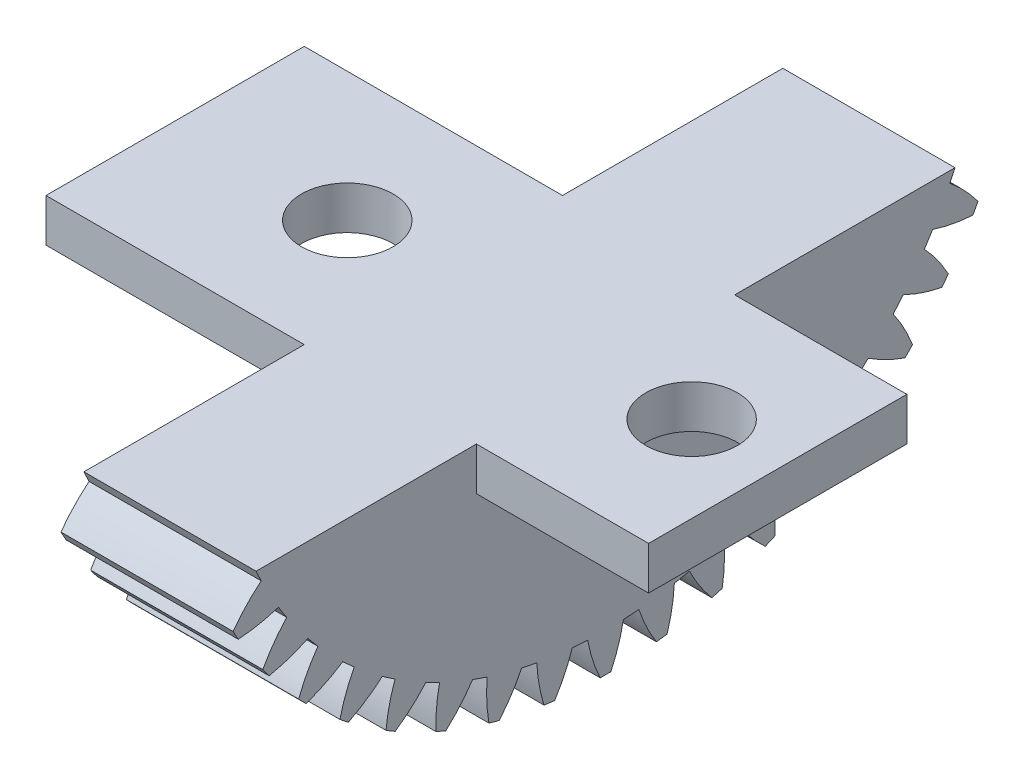
from build123d import *

# Parameters (mm, degrees)
BASPROSKE_W              = 12.7
BASPROSKE_H              = 31.115
TOOTHCUT_DEPTH           = 46.799306217
TEETHCUTS_COUNT          = 47
TEETHCUTS_ANGLE          = 352.340425532
BORSKE_R                 = 1.5875
BORE_DEPTH               = 50.8000508
CUT_EXTRUDE2_DEPTH       = 46.794769115
BOSS_EXTRUDE1_DEPTH      = 19.05
BOSS_EXTRUDE1_DEPTH_BACK = 12.7
SKETCH2_W                = 19.05
SKETCH2_H                = 3.175
SKETCH4_W                = 19.05
SKETCH4_H                = 3.175
BOSS_EXTRUDE2_DEPTH      = 12.7
F_1_4_CLEARANCE_HOLE1_D  = 6.7564


with BuildPart() as part:
    # BasProSke → Base-Revolve (revolve)
    with BuildSketch(Plane(origin=(0, 0, 0), x_dir=(1, 0, 0), z_dir=(0, 1, 0)), mode=Mode.PRIVATE) as base_revolve_sk:
        with Locations((6.35, 15.5575)):
            Rectangle(BASPROSKE_W, BASPROSKE_H)
    revolve(base_revolve_sk.sketch.rotate(Axis((-10, 0, 0), (1, 0, 0)), 180), axis=Axis((-10, 0, 0), (1, 0, 0)))

    # TooCutSke → ToothCut (cut, through all)
    with BuildSketch(Plane(origin=(0, 0, 0), x_dir=(0, 0, -1), z_dir=(1, 0, 0))):
        with BuildLine():
            ThreePointArc((0.567219539, 28.264509018), (0, 28.2702), (-0.567219539, 28.264509018))
            ThreePointArc((-0.567219539, 28.264509018), (-1.041703705, 29.715512743), (-1.697480705, 31.094100267))
            ThreePointArc((-1.697480705, 31.094100267), (0, 31.1404), (1.697480705, 31.094100267))
            ThreePointArc((1.697480705, 31.094100267), (1.041703705, 29.715512743), (0.567219539, 28.264509018))
        make_face()
    toothcut = extrude(amount=TOOTHCUT_DEPTH, mode=Mode.SUBTRACT)

    # TeethCuts: ToothCut ×47 about axis
    teethcuts_axis = Axis((-10, 0, 0), (1, 0, 0))
    for i in range(1, TEETHCUTS_COUNT):
        add(toothcut.rotate(teethcuts_axis, i * TEETHCUTS_ANGLE / (TEETHCUTS_COUNT - 1)), mode=Mode.SUBTRACT)

    # BorSke → Bore (cut, symmetric)
    with BuildSketch(Plane(origin=(0, 0, 0), x_dir=(0, 0, -1), z_dir=(1, 0, 0))):
        with Locations(Location((0, 0, 0), (0, 0, 180))):
            Circle(BORSKE_R)
    extrude(amount=BORE_DEPTH, both=True, mode=Mode.SUBTRACT)

    # Sketch1 → Cut-Extrude2 (cut, through all)
    with BuildSketch(Plane(origin=(12.7, 0, 0), x_dir=(0, 0, -1), z_dir=(1, 0, 0))):
        with BuildLine():
            Line((28.868706313, -11.6078), (-28.868706313, -11.6078))
            ThreePointArc((-28.868706313, -11.6078), (0, 31.115), (28.868706313, -11.6078))
        make_face()
    extrude(amount=-CUT_EXTRUDE2_DEPTH, mode=Mode.SUBTRACT)

    # Sketch2 → Boss-Extrude1 (add, two sides: drawn at the far end of the back side and taken through both)
    with BuildSketch(Plane.ZY.offset(-BOSS_EXTRUDE1_DEPTH_BACK)):
        with Locations((0, -13.1953)):
            Rectangle(SKETCH2_W, SKETCH2_H)
    extrude(amount=BOSS_EXTRUDE1_DEPTH + BOSS_EXTRUDE1_DEPTH_BACK)

    # Sketch4 → Boss-Extrude2 (add)
    with BuildSketch(Plane(origin=(12.7, 0, 0), x_dir=(0, 0, -1), z_dir=(1, 0, 0))):
        with Locations((0, -13.1953)):
            Rectangle(SKETCH4_W, SKETCH4_H)
    extrude(amount=BOSS_EXTRUDE2_DEPTH)

    # 1/4 Clearance Hole1 (through all)
    with Locations(Plane(origin=(19.05, -11.6078, 0), x_dir=(0, 0, 1), z_dir=(0, 1, 0))):
        with Locations((0, 0), (0, -25.4)):
            Hole(F_1_4_CLEARANCE_HOLE1_D / 2)


solid = part.part
